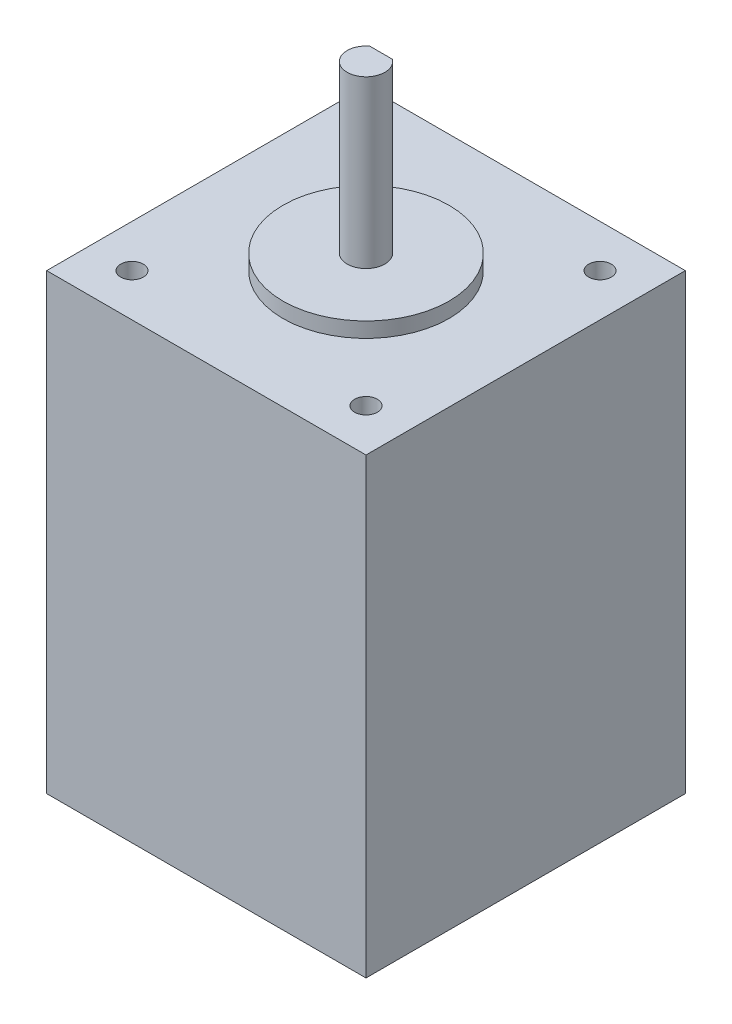
from build123d import *

# Parameters (mm, degrees)
SKETCH_1_W          = 42.3
SKETCH_1_H          = 42.3
SKETCH_1_R          = 1.5
EXTRUDE_1_DEPTH     = 60
SKETCH_2_R          = 11
EXTRUDE_2_DEPTH     = 2
SKETCH_3_R          = 2.5
EXTRUDE_3_DEPTH     = 22
SKETCH_4_W          = 5
SKETCH_4_H          = 0.5
CUT_EXTRUDE_1_DEPTH = 20


with BuildPart() as part:
    # Эскиз1 → Бобышка-Вытянуть1 (new body)
    with BuildSketch(Plane(origin=(0, 0, 0), x_dir=(1, 0, 0), z_dir=(0, 1, 0))):
        with Locations((21.15, 21.15)):
            Rectangle(SKETCH_1_W, SKETCH_1_H)
        with Locations(Location((5.65, 36.65, 0), (0, 0, 270))):
            Circle(SKETCH_1_R, mode=Mode.SUBTRACT)
        with Locations(Location((36.65, 36.65, 0), (0, 0, 270))):
            Circle(SKETCH_1_R, mode=Mode.SUBTRACT)
        with Locations(Location((36.65, 5.65, 0), (0, 0, 270))):
            Circle(SKETCH_1_R, mode=Mode.SUBTRACT)
        with Locations(Location((5.65, 5.65, 0), (0, 0, 270))):
            Circle(SKETCH_1_R, mode=Mode.SUBTRACT)
    extrude(amount=EXTRUDE_1_DEPTH)

    # Эскиз2 → Бобышка-Вытянуть2 (add)
    with BuildSketch(Plane(origin=(0, 60, 0), x_dir=(1, 0, 0), z_dir=(0, 1, 0))):
        with Locations(Location((21.15, 21.15, 0), (0, 0, 90))):
            Circle(SKETCH_2_R)
    extrude(amount=EXTRUDE_2_DEPTH)

    # Эскиз3 → Бобышка-Вытянуть3 (add)
    with BuildSketch(Plane(origin=(0, 62, 0), x_dir=(1, 0, 0), z_dir=(0, 1, 0))):
        with Locations(Location((21.15, 21.15, 0), (0, 0, 270))):
            Circle(SKETCH_3_R)
    extrude(amount=EXTRUDE_3_DEPTH)

    # Эскиз4 → Вырез-Вытянуть1 (cut)
    with BuildSketch(Plane(origin=(0, 84, 0), x_dir=(1, 0, 0), z_dir=(0, 1, 0))):
        with Locations((21.15, 23.4)):
            Rectangle(SKETCH_4_W, SKETCH_4_H)
    extrude(amount=-CUT_EXTRUDE_1_DEPTH, mode=Mode.SUBTRACT)


solid = part.part
